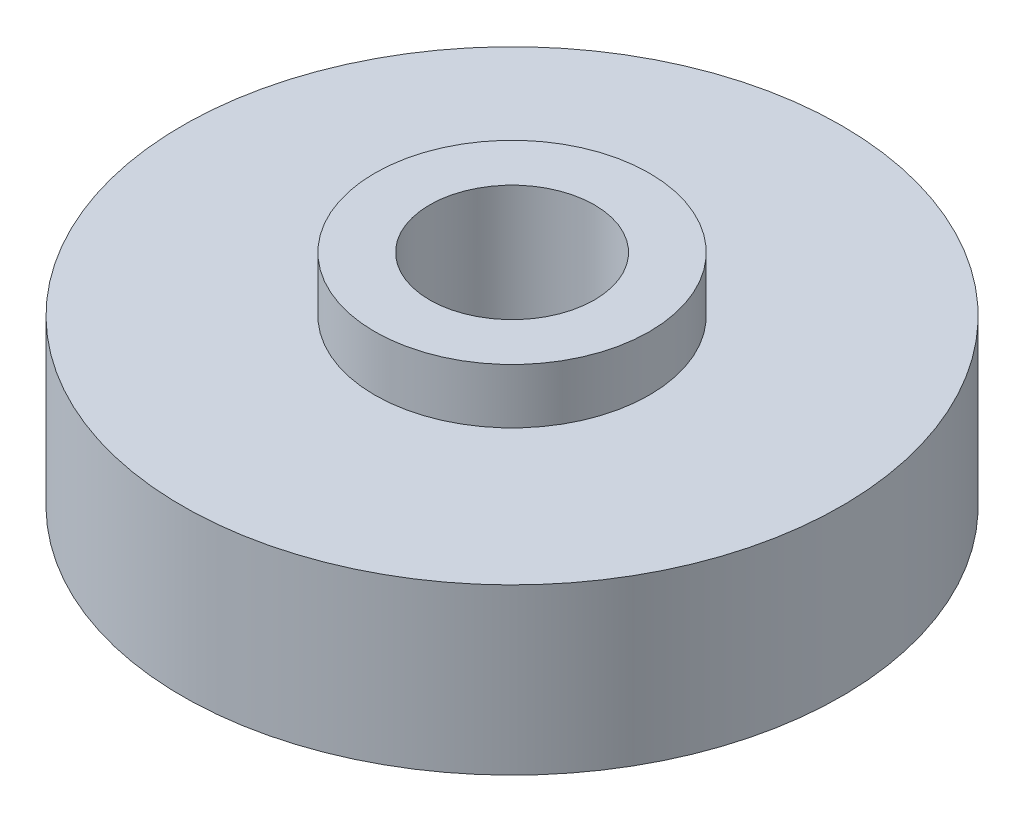
from build123d import *
from build123d.topology import SkipClean

# Parameters (mm, degrees)
SKETCH_1_R      = 2.5
SKETCH_1_R_2    = 1.5
EXTRUDE_1_DEPTH = 1
EXTRUDE_START   = 3
SKETCH_2_R      = 6
SKETCH_2_R_2    = 1.5
EXTRUDE_2_DEPTH = 3


with BuildPart() as part:
    # 草图1 → 凸台-拉伸1 (new body)
    with BuildSketch(Plane(origin=(0, 0, 0), x_dir=(1, 0, 0), z_dir=(0, 1, 0))):
        with Locations(Location((0, 0, 0), (0, 0, 270))):
            Circle(SKETCH_1_R)
        with Locations(Location((0, 0, 0), (0, 0, 270))):
            Circle(SKETCH_1_R_2, mode=Mode.SUBTRACT)
    extrude(amount=EXTRUDE_1_DEPTH)

    # 草图2 → 凸台-拉伸2 (add)
    with SkipClean():  # the faces are left unmerged after this step: merging them gives an invalid solid
        with BuildSketch(Plane.XZ.offset(EXTRUDE_START)):
            with Locations(Location((0, 0, 0), (0, 0, 270))):
                Circle(SKETCH_2_R)
            with Locations(Location((0, 0, 0), (0, 0, 270))):
                Circle(SKETCH_2_R_2, mode=Mode.SUBTRACT)
        extrude(amount=-EXTRUDE_2_DEPTH)


solid = part.part
